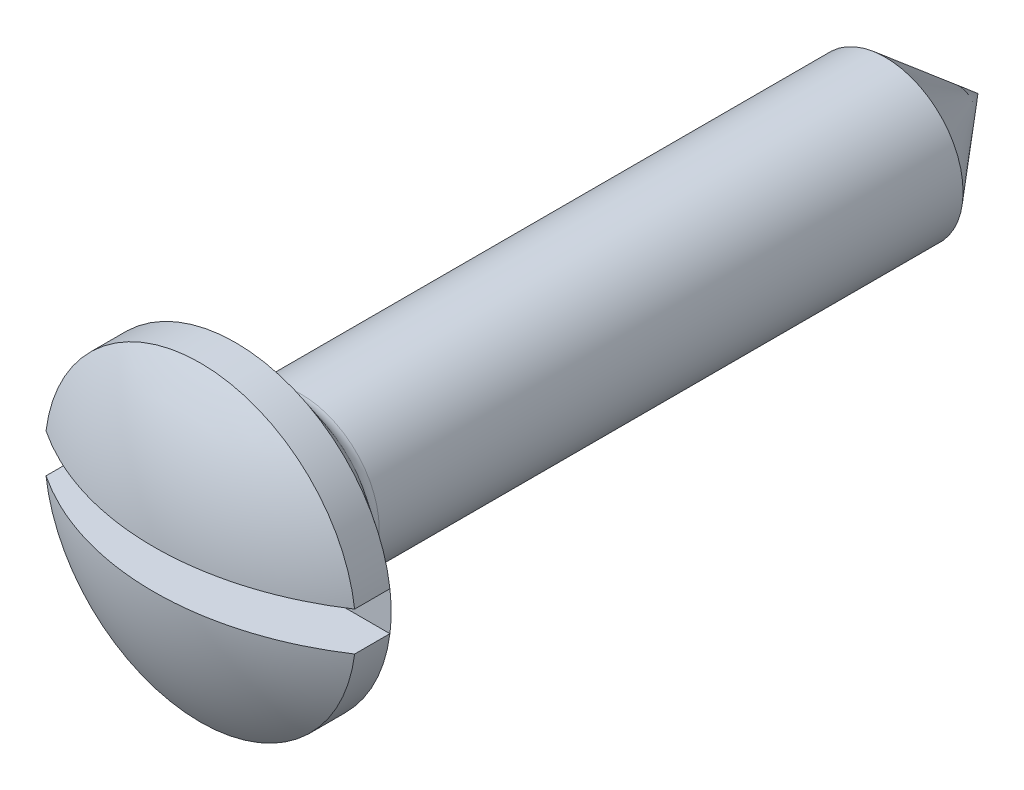
from build123d import *

# Parameters (mm, degrees)
SKETCH_2_W          = 10
SKETCH_2_H          = 0.5
CUT_EXTRUDE_1_DEPTH = 1.06


with BuildPart() as part:
    # 草图1 → 旋转1 (revolve)
    with BuildSketch(Plane(origin=(0, 0, 0), x_dir=(0, 0, -1), z_dir=(1, 0, 0)), mode=Mode.PRIVATE) as revolve_1_sk:
        with BuildLine():
            Line((0, 0), (10.606674091, 0))
            Line((10.606674091, 0), (9.414920498, 1))
            Line((9.414920498, 1), (1.906940731, 1))
            ThreePointArc((1.906940731, 1), (1.817307372, 1.021210009), (1.746685257, 1.08034139))
            Line((1.746685257, 1.08034139), (1.06, 2))
            Line((1.06, 2), (0.606674091, 2))
            ThreePointArc((0.606674091, 2), (0.155005568, 1.044994432), (0, 0))
        make_face()
    revolve(revolve_1_sk.sketch.rotate(Axis((0, 0, 0), (0, 0, -1)), 90), axis=Axis((0, 0, 0), (0, 0, -1)))

    # 草图2 → 切除-拉伸1 (cut)
    with BuildSketch(Plane.XY):
        Rectangle(SKETCH_2_W, SKETCH_2_H)
    extrude(amount=-CUT_EXTRUDE_1_DEPTH, mode=Mode.SUBTRACT)


solid = part.part
